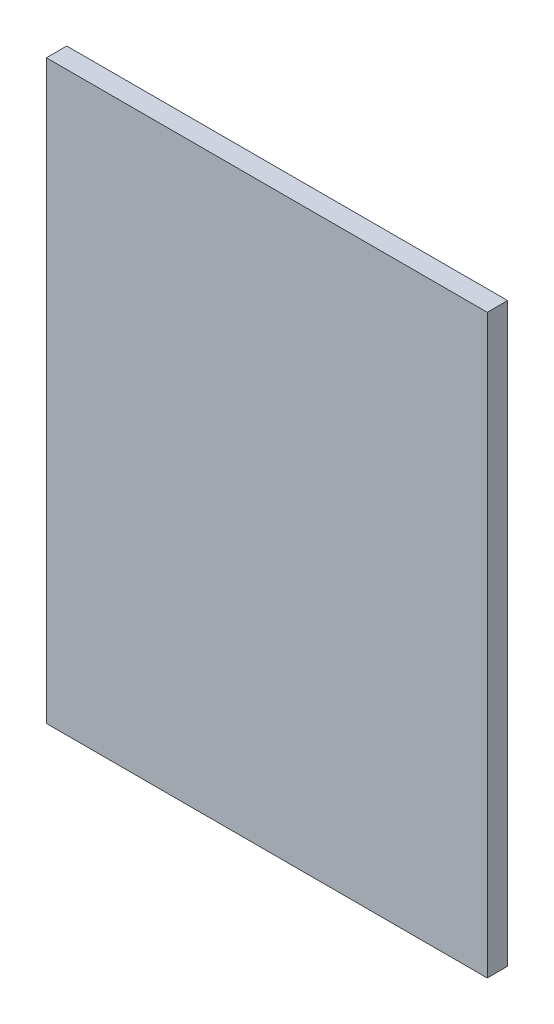
from build123d import *

# Parameters (mm, degrees)
SKETCH1_W            = 650
SKETCH1_H            = 850
REFERENCE_ONLY_DEPTH = 30


with BuildPart() as part:
    # Sketch1 → Reference_only (new body)
    with BuildSketch(Plane.XY):
        with Locations((325, 425)):
            Rectangle(SKETCH1_W, SKETCH1_H)
    extrude(amount=REFERENCE_ONLY_DEPTH)


solid = part.part
